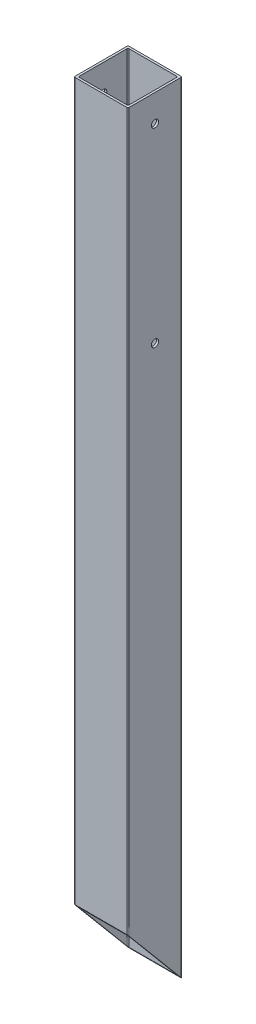
from build123d import *

# Parameters (mm, degrees)
BOSS_EXTRU_1_DEPTH      = 1500
ESQUISSE4_R             = 6.75
ENL_V_MAT_EXTRU_1_DEPTH = 1507.651917332


with BuildPart() as part:
    # Esquisse2 → Boss.-Extru.1 (new body)
    with BuildSketch(Plane(origin=(0, 0, 0), x_dir=(1, 0, 0), z_dir=(0, 1, 0))):
        with BuildLine():
            Line((2, 0), (98, 0))
            ThreePointArc((98, 0), (99.414213562, 0.585786438), (100, 2))
            Line((100, 2), (100, 98))
            ThreePointArc((100, 98), (99.414213562, 99.414213562), (98, 100))
            Line((98, 100), (2, 100))
            ThreePointArc((2, 100), (0.585786438, 99.414213562), (0, 98))
            Line((0, 98), (0, 2))
            ThreePointArc((0, 2), (0.585786438, 0.585786438), (2, 0))
        make_face()
        with BuildLine():
            Line((6, 96), (94, 96))
            ThreePointArc((94, 96), (95.414213562, 95.414213562), (96, 94))
            Line((96, 94), (96, 6))
            ThreePointArc((96, 6), (95.414213562, 4.585786438), (94, 4))
            Line((94, 4), (6, 4))
            ThreePointArc((6, 4), (4.585786438, 4.585786438), (4, 6))
            Line((4, 6), (4, 94))
            ThreePointArc((4, 94), (4.585786438, 95.414213562), (6, 96))
        make_face(mode=Mode.SUBTRACT)
    extrude(amount=BOSS_EXTRU_1_DEPTH)

    # Esquisse4 → Enlèv. mat.-Extru.1 (cut, through all)
    with BuildSketch(Plane.ZY):
        with Locations((-50, 1450)):
            Circle(ESQUISSE4_R)
        with Locations((-50, 1098)):
            Circle(ESQUISSE4_R)
        Polygon((0, 174), (-165.464535812, -23.192955001), (56.265885145, -23.192955001), (56.265885145, 174), align=None)
    extrude(amount=-ENL_V_MAT_EXTRU_1_DEPTH, mode=Mode.SUBTRACT)


solid = part.part
